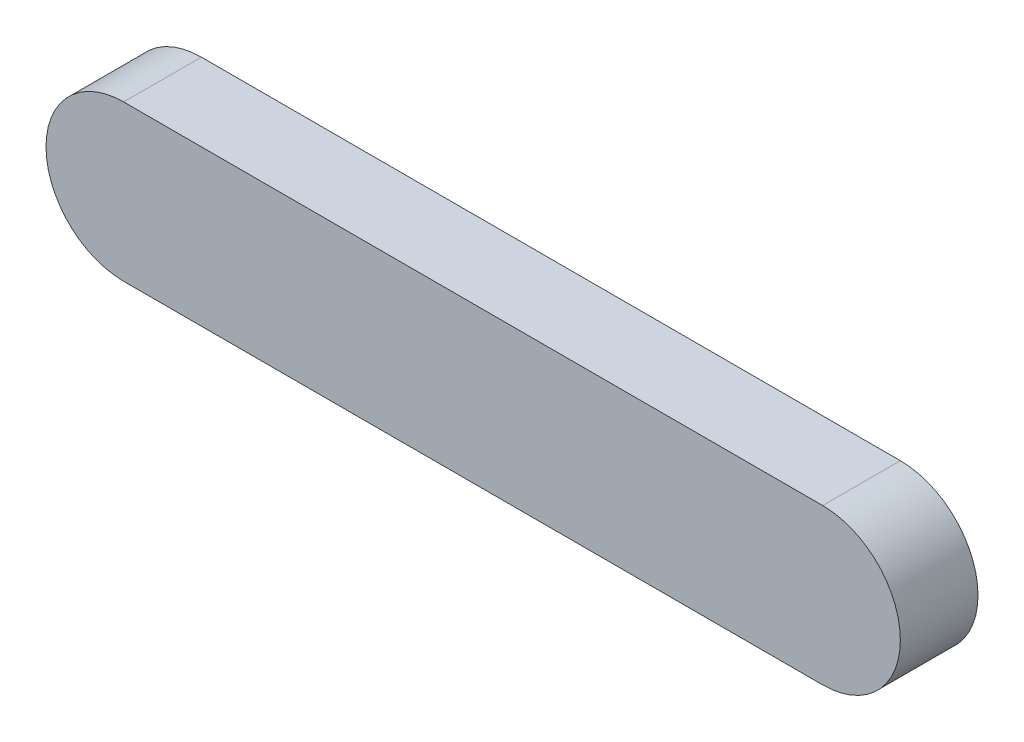
from build123d import *

# Parameters (mm, degrees)
BOSS_EXTRUDE1_DEPTH = 12.7
CUT_EXTRUDE1_DEPTH  = 6.35
CUT_EXTRUDE4_START  = 3.81
CUT_EXTRUDE4_DEPTH  = 3.81
CUT_EXTRUDE5_START  = 5.08
CUT_EXTRUDE5_DEPTH  = 5.08


with BuildPart() as part:
    # Sketch1 → Boss-Extrude1 (new body)
    with BuildSketch(Plane.XY):
        with BuildLine():
            Line((0, 0), (114.3, 0))
            ThreePointArc((114.3, 0), (127, -12.7), (114.3, -25.4))
            Line((114.3, -25.4), (0, -25.4))
            ThreePointArc((0, -25.4), (-12.7, -12.7), (0, 0))
        make_face()
    extrude(amount=-BOSS_EXTRUDE1_DEPTH)

    # Sketch2 → Cut-Extrude1 (cut)
    with BuildSketch(Plane(origin=(0, 0, -12.7), x_dir=(-1, 0, 0), z_dir=(0, 0, -1))):
        with BuildLine():
            Line((-118.872586333, -11.6205), (-118.872586333, -13.7795))
            Line((-118.872586333, -13.7795), (-117.285850758, -13.7795))
            ThreePointArc((-117.285850758, -13.7795), (-114.3, -15.875), (-111.314149242, -13.7795))
            Line((-111.314149242, -13.7795), (-109.727413667, -13.7795))
            Line((-109.727413667, -13.7795), (-109.727413667, -11.6205))
            Line((-109.727413667, -11.6205), (-111.314149242, -11.6205))
            ThreePointArc((-111.314149242, -11.6205), (-114.3, -9.525), (-117.285850758, -11.6205))
            Line((-117.285850758, -11.6205), (-118.872586333, -11.6205))
        make_face()
        with BuildLine():
            Line((-4.572586333, -11.6205), (-2.985850758, -11.6205))
            ThreePointArc((-2.985850758, -11.6205), (0, -9.525), (2.985850758, -11.6205))
            Line((2.985850758, -11.6205), (4.572586333, -11.6205))
            Line((4.572586333, -11.6205), (4.572586333, -13.7795))
            Line((4.572586333, -13.7795), (2.985850758, -13.7795))
            ThreePointArc((2.985850758, -13.7795), (0, -15.875), (-2.985850758, -13.7795))
            Line((-2.985850758, -13.7795), (-4.572586333, -13.7795))
            Line((-4.572586333, -13.7795), (-4.572586333, -11.6205))
        make_face()
    extrude(amount=-CUT_EXTRUDE1_DEPTH, mode=Mode.SUBTRACT)

    # Sketch3 → Cut-Extrude4 (cut)
    with BuildSketch(Plane(origin=(0, 0, -6.35), x_dir=(-1, 0, 0), z_dir=(0, 0, -1)).offset(CUT_EXTRUDE4_START)):
        with BuildLine():
            ThreePointArc((-113.2205, -8.127413667), (-116.769985033, -8.703371426), (-118.872586333, -11.6205))
            Line((-118.872586333, -11.6205), (-117.285850758, -11.6205))
            ThreePointArc((-117.285850758, -11.6205), (-115.647993548, -9.825362911), (-113.2205, -9.714149242))
            Line((-113.2205, -9.714149242), (-113.2205, -8.127413667))
        make_face()
        with BuildLine():
            Line((-109.727413667, -13.7795), (-111.314149242, -13.7795))
            ThreePointArc((-111.314149242, -13.7795), (-112.952006452, -15.574637089), (-115.3795, -15.685850758))
            Line((-115.3795, -15.685850758), (-115.3795, -17.272586333))
            ThreePointArc((-115.3795, -17.272586333), (-111.830014967, -16.696628574), (-109.727413667, -13.7795))
        make_face()
        with BuildLine():
            ThreePointArc((-1.0795, -8.127413667), (2.469985033, -8.703371426), (4.572586333, -11.6205))
            Line((4.572586333, -11.6205), (2.985850758, -11.6205))
            ThreePointArc((2.985850758, -11.6205), (1.347993548, -9.825362911), (-1.0795, -9.714149242))
            Line((-1.0795, -9.714149242), (-1.0795, -8.127413667))
        make_face()
        with BuildLine():
            ThreePointArc((1.0795, -17.272586333), (-2.469985033, -16.696628574), (-4.572586333, -13.7795))
            Line((-4.572586333, -13.7795), (-2.985850758, -13.7795))
            ThreePointArc((-2.985850758, -13.7795), (-1.347993548, -15.574637089), (1.0795, -15.685850758))
            Line((1.0795, -15.685850758), (1.0795, -17.272586333))
        make_face()
    extrude(amount=-CUT_EXTRUDE4_DEPTH, mode=Mode.SUBTRACT)

    # Sketch4 → Cut-Extrude5 (cut)
    with BuildSketch(Plane(origin=(0, 0, -6.35), x_dir=(-1, 0, 0), z_dir=(0, 0, -1)).offset(CUT_EXTRUDE5_START)):
        with BuildLine():
            Line((-113.2205, -9.714149242), (-113.2205, -8.127413667))
            Line((-113.2205, -8.127413667), (-115.3795, -8.127413667))
            Line((-115.3795, -8.127413667), (-115.3795, -9.714149242))
            ThreePointArc((-115.3795, -9.714149242), (-115.099019405, -9.627184843), (-114.8117038, -9.566506068))
            ThreePointArc((-114.8117038, -9.566506068), (-114.006661019, -9.538579869), (-113.2205, -9.714149242))
        make_face()
        with BuildLine():
            ThreePointArc((-115.3795, -15.685850758), (-114.3, -15.875), (-113.2205, -15.685850758))
            Line((-113.2205, -15.685850758), (-113.2205, -17.272586333))
            Line((-113.2205, -17.272586333), (-115.3795, -17.272586333))
            Line((-115.3795, -17.272586333), (-115.3795, -15.685850758))
        make_face()
    cut_extrude5 = extrude(amount=-CUT_EXTRUDE5_DEPTH, mode=Mode.SUBTRACT)

    # Mirror2: Cut-Extrude5 across plane
    add(cut_extrude5.mirror(Plane(origin=(57.15, 0, 0), x_dir=(0, 0, 1), z_dir=(1, 0, 0))), mode=Mode.SUBTRACT)


solid = part.part
